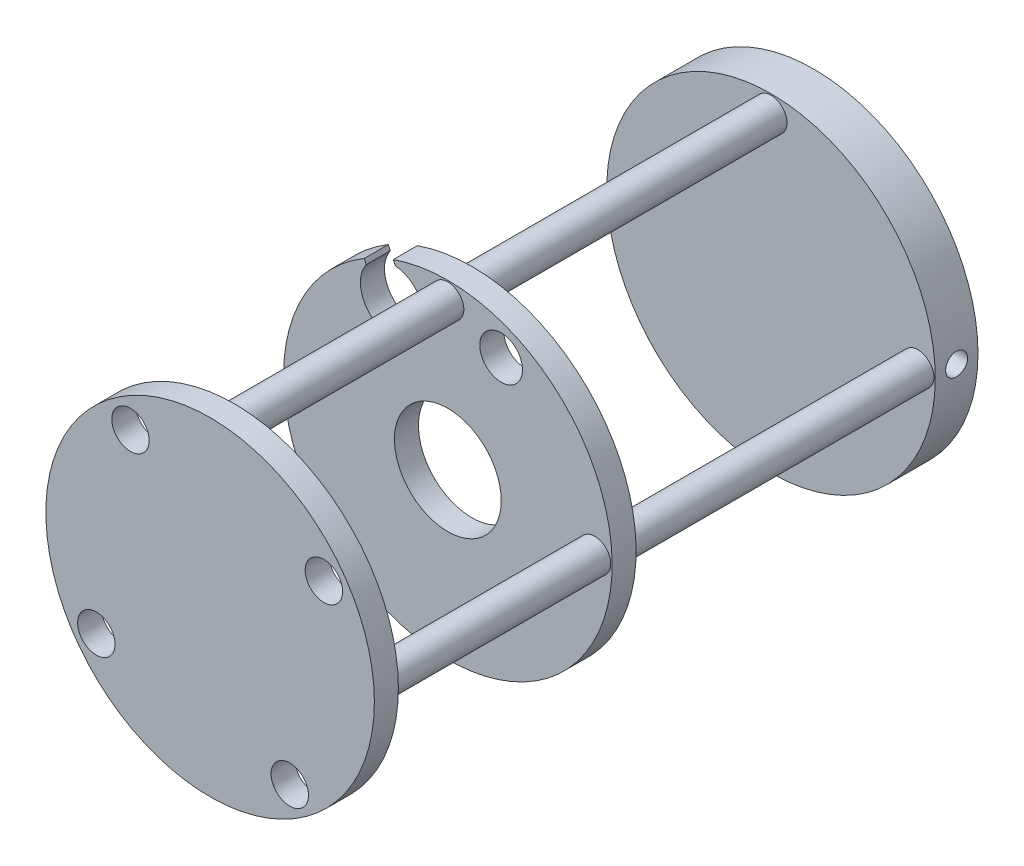
from build123d import *

# Parameters (mm, degrees)
ESQUISSE1_R             = 30.75
BOSS_EXTRU_1_DEPTH      = 8
ESQUISSE2_R             = 3
BOSS_EXTRU_2_DEPTH      = 56
ESQUISSE4_R             = 30.75
BOSS_EXTRU_4_DEPTH      = 4.5
ESQUISSE6_R             = 3
BOSS_EXTRU_5_DEPTH      = 40
ESQUISSE12_R            = 4
ENL_V_MAT_EXTRU_1_DEPTH = 6
ENL_V_START             = -10
ENL_V_MAT_EXTRU_2_DEPTH = 10
ESQUISSE15_R            = 10
ENL_V_MAT_EXTRU_3_DEPTH = 10
ESQUISSE18_R            = 30.75
BOSS_EXTRU_10_DEPTH     = 4.5
ESQUISSE19_R            = 2.05
ENL_V_MAT_EXTRU_4_DEPTH = 62
ESQUISSE20_R            = 3.5
ENL_V_MAT_EXTRU_5_DEPTH = 10


with BuildPart() as part:
    # Esquisse1 → Boss.-Extru.1 (new body)
    with BuildSketch(Plane.XY):
        Circle(ESQUISSE1_R)
    extrude(amount=BOSS_EXTRU_1_DEPTH)

    # Esquisse2 → Boss.-Extru.2 (add)
    with BuildSketch(Plane.XY.offset(8)):
        with Locations((0, 27.5)):
            Circle(ESQUISSE2_R)
        with Locations((27.5, 0)):
            Circle(ESQUISSE2_R)
        with Locations((-27.5, 0)):
            Circle(ESQUISSE2_R)
        with Locations((0, -27.5)):
            Circle(ESQUISSE2_R)
    extrude(amount=BOSS_EXTRU_2_DEPTH)

    # Esquisse4 → Boss.-Extru.4 (add)
    with BuildSketch(Plane.XY.offset(64)):
        Circle(ESQUISSE4_R)
    extrude(amount=BOSS_EXTRU_4_DEPTH)

    # Esquisse6 → Boss.-Extru.5 (add)
    with BuildSketch(Plane.XY.offset(68.5)):
        with Locations((0, -27.5)):
            Circle(ESQUISSE6_R)
        with Locations((-27.5, 0)):
            Circle(ESQUISSE6_R)
        with Locations((0, 27.5)):
            Circle(ESQUISSE6_R)
        with Locations((27.5, 0)):
            Circle(ESQUISSE6_R)
    extrude(amount=BOSS_EXTRU_5_DEPTH)

    # Esquisse12 → Enlèv. mat.-Extru.1 (cut)
    with BuildSketch(Plane.XY.offset(68.5)):
        with Locations((9.98690327, 23.224420757)):
            Circle(ESQUISSE12_R)
    extrude(amount=-ENL_V_MAT_EXTRU_1_DEPTH, mode=Mode.SUBTRACT)

    # Esquisse13 → Enlèv. mat.-Extru.2 (cut)
    with BuildSketch(Plane.XY.offset(68.5).offset(ENL_V_START)):
        with BuildLine():
            Line((-15.652440464, 26.468162149), (-15.269059678, 25.645999401))
            ThreePointArc((-15.269059678, 25.645999401), (-7.818437842, 16.76669406), (-9.831212956, 28.181708971))
            Line((-9.831212956, 28.181708971), (-10.214593742, 29.003871719))
            ThreePointArc((-10.214593742, 29.003871719), (-12.995511549, 27.868964451), (-15.652440464, 26.468162149))
        make_face()
    extrude(amount=ENL_V_MAT_EXTRU_2_DEPTH, mode=Mode.SUBTRACT)

    # Esquisse15 → Enlèv. mat.-Extru.3 (cut)
    with BuildSketch(Plane.XY.offset(68.5)):
        Circle(ESQUISSE15_R)
    extrude(amount=-ENL_V_MAT_EXTRU_3_DEPTH, mode=Mode.SUBTRACT)

    # Esquisse18 → Boss.-Extru.10 (add)
    with BuildSketch(Plane.XY.offset(108.5)):
        Circle(ESQUISSE18_R)
    extrude(amount=BOSS_EXTRU_10_DEPTH)

    # Esquisse19 → Enlèv. mat.-Extru.4 (cut)
    with BuildSketch(Plane.ZY.offset(30.75)):
        with Locations((4, 0.25)):
            Circle(ESQUISSE19_R)
    extrude(amount=-ENL_V_MAT_EXTRU_4_DEPTH, mode=Mode.SUBTRACT)

    # Esquisse20 → Enlèv. mat.-Extru.5 (cut)
    with BuildSketch(Plane.XY.offset(113)):
        with Locations((21.297953152, 14.912987345)):
            Circle(ESQUISSE20_R)
        with Locations((-14.912987345, 21.297953152)):
            Circle(ESQUISSE20_R)
        with Locations((-21.297953152, -14.912987345)):
            Circle(ESQUISSE20_R)
        with Locations((14.912987345, -21.297953152)):
            Circle(ESQUISSE20_R)
    extrude(amount=-ENL_V_MAT_EXTRU_5_DEPTH, mode=Mode.SUBTRACT)


solid = part.part
